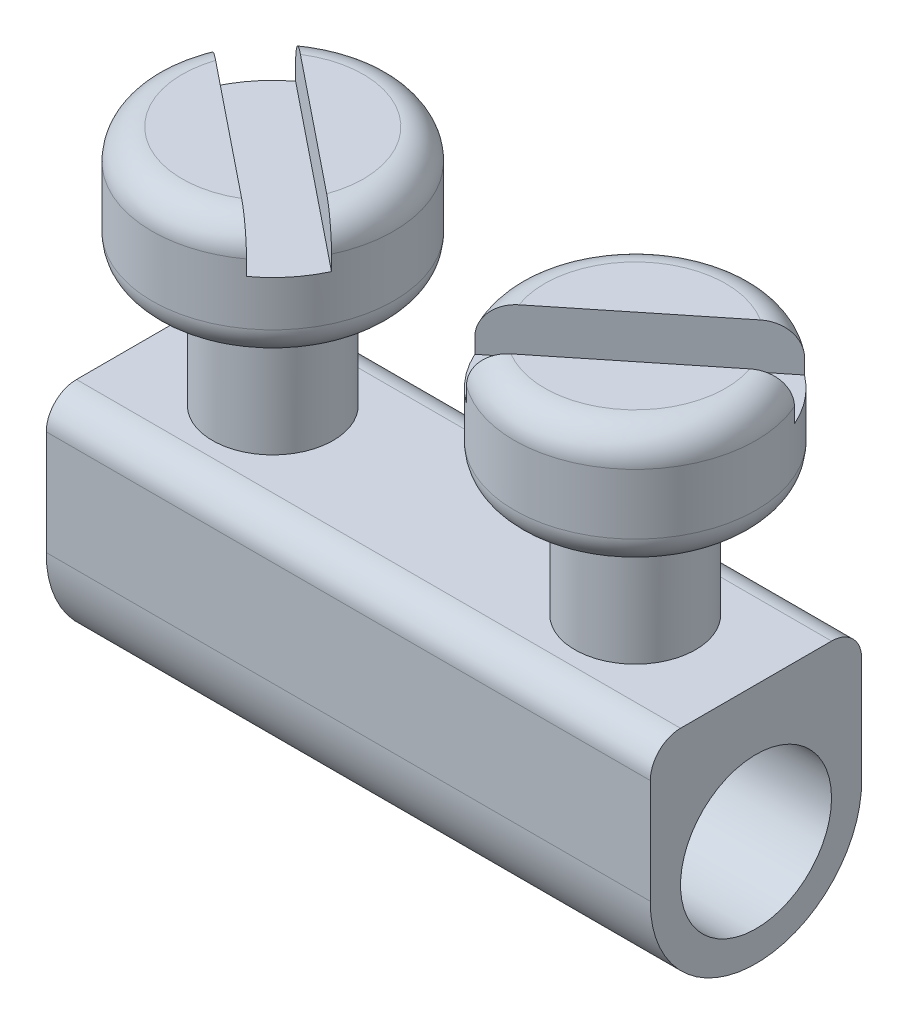
from build123d import *

# Parameters (mm, degrees)
SKETCH_1_R          = 1.25
EXTRUDE_1_DEPTH     = 5
SKETCH_2_R          = 1
EXTRUDE_8_DEPTH     = 4
EXTRUDE_START       = -2
SKETCH_2_2_R        = 1
EXTRUDE_9_DEPTH     = 2
SKETCH_4_R          = 2
EXTRUDE_10_DEPTH    = 2
CUT_EXTRUDE_1_DEPTH = 0.75
FILLET_2_R          = 0.5


with BuildPart() as part:
    # Эскиз1 → Бобышка-Вытянуть1 (new, symmetric)
    with BuildSketch(Plane(origin=(0, 0, 0), x_dir=(0, 0, -1), z_dir=(1, 0, 0))):
        with BuildLine():
            Line((-1.75, 2.202634141), (1.75, 2.202634141))
            Line((1.75, 2.202634141), (1.75, -0.028893504))
            ThreePointArc((1.75, -0.028893504), (0, -1.797365859), (-1.75, -0.028893504))
            Line((-1.75, -0.028893504), (-1.75, 2.202634141))
        make_face()
        with Locations((0, -0.047269384)):
            Circle(SKETCH_1_R, mode=Mode.SUBTRACT)
    extrude(amount=EXTRUDE_1_DEPTH, both=True)

    # Эскиз2 → Бобышка-Вытянуть8 (add)
    with BuildSketch(Plane(origin=(0, 2.202634141, 0), x_dir=(1, 0, 0), z_dir=(0, 1, 0))):
        with Locations((3, 0)):
            Circle(SKETCH_2_R)
        with Locations((-3, 0)):
            Circle(SKETCH_2_R)
    extrude(amount=EXTRUDE_8_DEPTH)

    # Эскиз2<2> → Бобышка-Вытянуть9 (add)
    with BuildSketch(Plane(origin=(0, 2.202634141, 0), x_dir=(1, 0, 0), z_dir=(0, 1, 0)).offset(EXTRUDE_START)):
        with Locations((3, 0)):
            Circle(SKETCH_2_2_R)
        with Locations((-3, 0)):
            Circle(SKETCH_2_2_R)
    extrude(amount=EXTRUDE_9_DEPTH)

    # Эскиз4 → Бобышка-Вытянуть10 (add)
    with BuildSketch(Plane(origin=(0, 6.202634141, 0), x_dir=(1, 0, 0), z_dir=(0, 1, 0))):
        with Locations((-3, 0)):
            Circle(SKETCH_4_R)
        with Locations((3, 0)):
            Circle(SKETCH_4_R)
    extrude(amount=-EXTRUDE_10_DEPTH)

    # Эскиз4<3> → Вырез-Вытянуть1 (cut)
    with BuildSketch(Plane(origin=(0, 6.202634141, 0), x_dir=(1, 0, 0), z_dir=(0, 1, 0))):
        with BuildLine():
            ThreePointArc((-4.212535059, 1.590521528), (-4.571679225, 1.236860709), (-4.830997986, 0.804640526))
            Line((-4.830997986, 0.804640526), (-1.820365778, -1.615073714))
            ThreePointArc((-1.820365778, -1.615073714), (-1.454038392, -1.26885882), (-1.185902953, -0.842052198))
            Line((-1.185902953, -0.842052198), (-4.212535059, 1.590521528))
        make_face()
        with BuildLine():
            Line((1.820365778, -1.615073714), (4.830997986, 0.804640526))
            ThreePointArc((4.830997986, 0.804640526), (4.571679225, 1.236860709), (4.212535059, 1.590521528))
            Line((4.212535059, 1.590521528), (1.185902953, -0.842052198))
            ThreePointArc((1.185902953, -0.842052198), (1.454038392, -1.26885882), (1.820365778, -1.615073714))
        make_face()
    extrude(amount=-CUT_EXTRUDE_1_DEPTH, mode=Mode.SUBTRACT)

    # Скругление2
    fillet_2_edges = [part.edges().sort_by_distance(p)[0] for p in [
        (0, 2.202634141, 1.75),
        (0, 2.202634141, -1.75),
        (-4.252925752, 6.202634141, 1.558902518),
        (-2.112607786, 6.202634141, -1.792354613),
        (-5, 4.202634141, 0),
        (1, 4.202634141, 0),
        (1.747074248, 6.202634141, -1.558902518),
        (3.905740458, 6.202634141, 1.783152888),
    ]]
    fillet(fillet_2_edges, radius=FILLET_2_R)


solid = part.part
